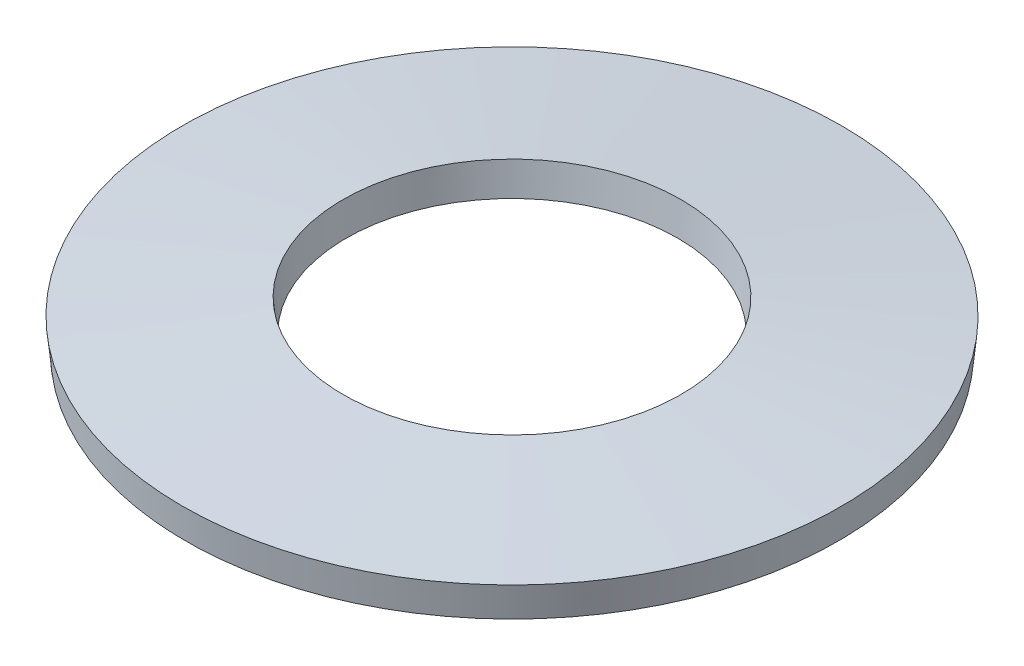
from build123d import *


with BuildPart() as part:
    # Sketch1 → Revolve1 (revolve)
    with BuildSketch(Plane.XY, mode=Mode.PRIVATE) as revolve1_sk:
        Polygon((22.006186048, 0), (11.176, 1.103316983), (11.394813952, 3.2512), (22.225, 2.147883017), align=None)
    revolve(revolve1_sk.sketch.rotate(Axis((0, 0, 0), (0, 1, 0)), 90), axis=Axis((0, 0, 0), (0, 1, 0)))


solid = part.part
